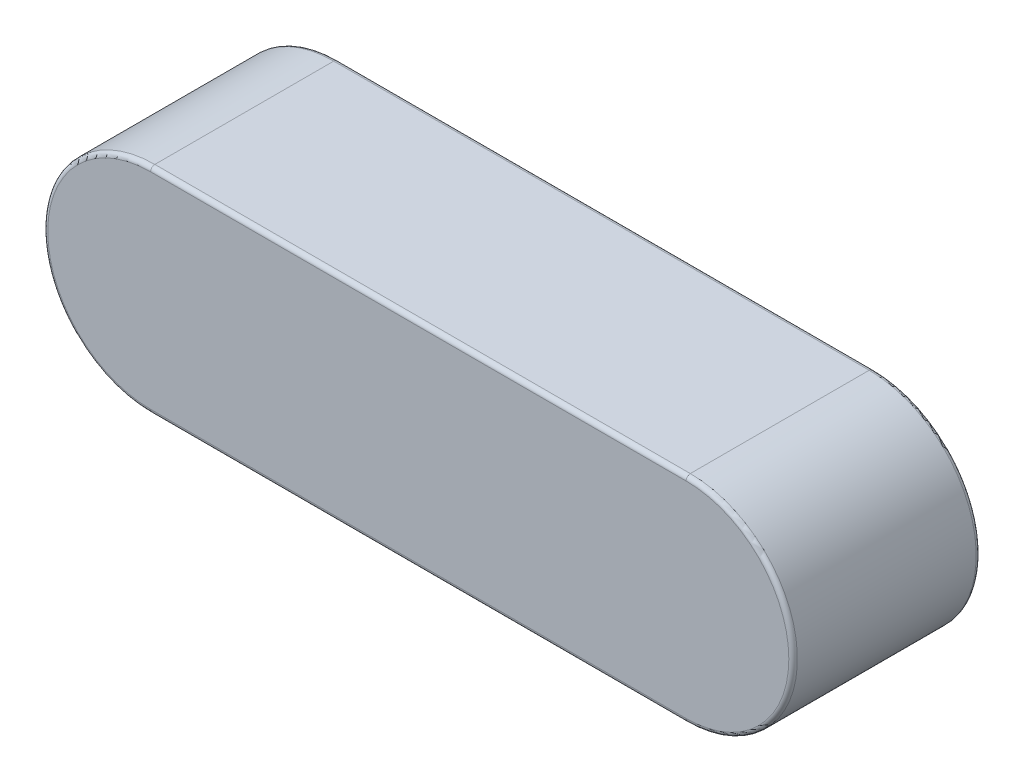
from build123d import *

# Parameters (mm, degrees)
EXTRUDE_1_DEPTH = 7
FILLET_1_R      = 0.16


with BuildPart() as part:
    # Эскиз1 → Бобышка-Вытянуть1 (new body)
    with BuildSketch(Plane.XY):
        with BuildLine():
            Line((0, 4), (20, 4))
            ThreePointArc((20, 4), (24, 0), (20, -4))
            Line((20, -4), (0, -4))
            ThreePointArc((0, -4), (-4, 0), (0, 4))
        make_face()
    extrude(amount=EXTRUDE_1_DEPTH)

    # Скругление1
    fillet_1_edges = [part.edges().sort_by_distance(p)[0] for p in [
        (24, 0, 7),
        (10, 4, 7),
        (-4, 0, 7),
        (10, 4, 0),
        (24, 0, 0),
        (10, -4, 0),
        (-4, 0, 0),
        (10, -4, 7),
    ]]
    fillet(fillet_1_edges, radius=FILLET_1_R)


solid = part.part
